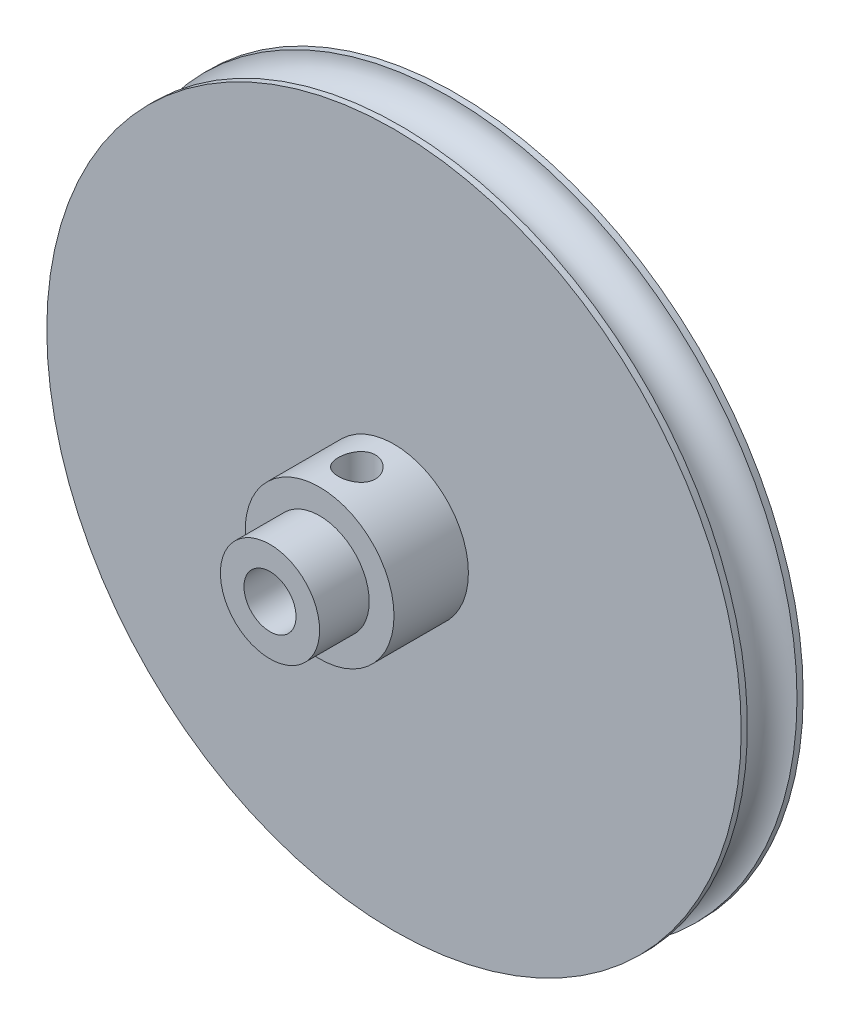
from build123d import *

# Parameters (mm, degrees)
ESQUISSE1_R                  = 28
BOSS_EXTRU_1_DEPTH           = 5
ESQUISSE2_R                  = 4
BOSS_EXTRU_2_DEPTH           = 10
ESQUISSE3_R                  = 2.1
ENL_V_MAT_EXTRU_1_DEPTH      = 43.343830719
ESQUISSE4_R                  = 2
ESQUISSE5_R                  = 6
ESQUISSE5_R_2                = 4
BOSS_EXTRU_3_DEPTH           = 6
ENL_V_MAT_EXTRU_2_REACH      = 44.344
ENL_V_MAT_EXTRU_2_END_RADIUS = 6
ESQUISSE6_R                  = 1.5


with BuildPart() as part:
    # Esquisse1 → Boss.-Extru.1 (new body)
    with BuildSketch(Plane.XY):
        Circle(ESQUISSE1_R)
    extrude(amount=BOSS_EXTRU_1_DEPTH)

    # Esquisse2 → Boss.-Extru.2 (add)
    with BuildSketch(Plane.XY.offset(5)):
        Circle(ESQUISSE2_R)
    extrude(amount=BOSS_EXTRU_2_DEPTH)

    # Esquisse3 → Enlèv. mat.-Extru.1 (cut, through all)
    with BuildSketch(Plane.XY.offset(15)):
        Circle(ESQUISSE3_R)
    extrude(amount=-ENL_V_MAT_EXTRU_1_DEPTH, mode=Mode.SUBTRACT)

    # Esquisse4 → Enlèvement de matière-Révolution1 (revolve, cut)
    with BuildSketch(Plane(origin=(0, 0, 0), x_dir=(0, 0, -1), z_dir=(1, 0, 0)), mode=Mode.PRIVATE) as enl_vement_de_mati_re_r_volution1_sk:
        with Locations((-2.5, 28)):
            Circle(ESQUISSE4_R)
    revolve(enl_vement_de_mati_re_r_volution1_sk.sketch.rotate(Axis((0, 0, 0), (0, 0, 1)), 90), axis=Axis((0, 0, 0), (0, 0, 1)), mode=Mode.SUBTRACT)

    # Esquisse5 → Boss.-Extru.3 (add)
    with BuildSketch(Plane.XY.offset(5)):
        Circle(ESQUISSE5_R)
        Circle(ESQUISSE5_R_2, mode=Mode.SUBTRACT)
    extrude(amount=BOSS_EXTRU_3_DEPTH)

    # Enlèv. mat.-Extru.2: up to this cylinder (the profile starts inside it)
    enl_v_mat_extru_2_end = Plane(origin=(0, 0, 8), z_dir=(0, 0, -1)) * Cylinder(ENL_V_MAT_EXTRU_2_END_RADIUS, 101.688, mode=Mode.PRIVATE)
    # Esquisse6 → Enlèv. mat.-Extru.2 (cut, up to the surface)
    with BuildSketch(Plane(origin=(0, 0, 0), x_dir=(1, 0, 0), z_dir=(0, 1, 0)), mode=Mode.PRIVATE) as enl_v_mat_extru_2_sk1:
        with Locations(Location((0, -8, 0), (0, 0, 90))):
            Circle(ESQUISSE6_R)
    enl_v_mat_extru_2_tool1 = extrude(enl_v_mat_extru_2_sk1.sketch, amount=ENL_V_MAT_EXTRU_2_REACH, mode=Mode.PRIVATE) & enl_v_mat_extru_2_end
    add(enl_v_mat_extru_2_tool1.solids().sort_by_distance((0, 0, 8))[0], mode=Mode.SUBTRACT)


solid = part.part
